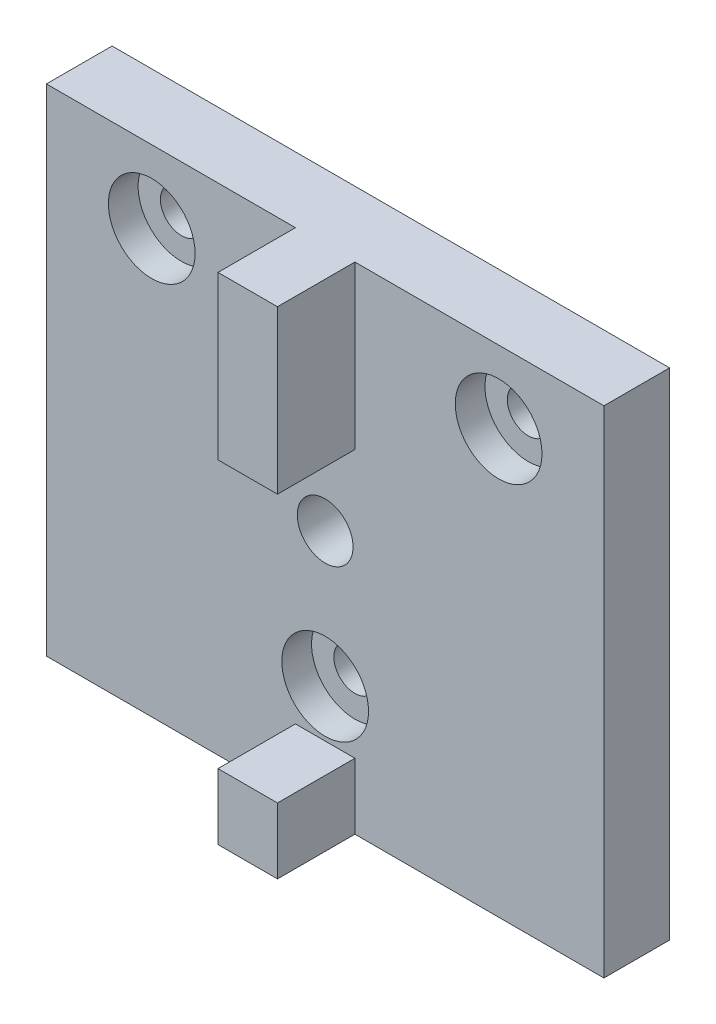
from build123d import *

# Parameters (mm, degrees)
BOSS_EXTRU_1_DEPTH                                 = 20
ESQUISSE19_W                                       = 4.8
ESQUISSE19_H                                       = 21.581272728
ENL_V_MAT_EXTRU_1_DEPTH                            = 6.25
CHAMBRAGE_POUR_VIS_T_TE_RONDE_BOMB_E_M_D           = 3.4
CHAMBRAGE_POUR_VIS_T_TE_RONDE_BOMB_E_M_CBORE_D     = 7
CHAMBRAGE_POUR_VIS_T_TE_RONDE_BOMB_E_M_CBORE_DEPTH = 2.4
D_GAGEMENT_M41_D                                   = 4.5


with BuildPart() as part:
    # Base → Boss.-Extru.1 (new, symmetric)
    with BuildSketch(Plane(origin=(0, 0, 0), x_dir=(1, 0, 0), z_dir=(0, 1, 0))):
        Polygon((-3, 10.061730862), (-2.4, 10.061730862), (-2.4, 3.811730862), (2.4, 3.811730862), (2.4, 10.061730862), (3, 10.061730862), (22.5, 10.061730862), (22.5, 15.361730862), (-22.5, 15.361730862), (-22.5, 10.061730862), align=None)
    extrude(amount=BOSS_EXTRU_1_DEPTH, both=True)

    # Esquisse19 → Enlèv. mat.-Extru.1 (cut)
    with BuildSketch(Plane.XY.offset(-3.811730862)):
        with Locations((0, -3.896618687)):
            Rectangle(ESQUISSE19_W, ESQUISSE19_H)
    extrude(amount=-ENL_V_MAT_EXTRU_1_DEPTH, mode=Mode.SUBTRACT)

    # Chambrage pour vis à tête ronde bombée M31 (through all)
    with Locations(Plane.XY.offset(-10.061730862)):
        with Locations((-14, 14.142273416), (14, 14.142273416), (0, -10.857726584)):
            CounterBoreHole(CHAMBRAGE_POUR_VIS_T_TE_RONDE_BOMB_E_M_D / 2, CHAMBRAGE_POUR_VIS_T_TE_RONDE_BOMB_E_M_CBORE_D / 2, CHAMBRAGE_POUR_VIS_T_TE_RONDE_BOMB_E_M_CBORE_DEPTH)

    # Dégagement M41 (through all)
    with Locations(Plane(origin=(0, 0, -15.361730862), x_dir=(-1, 0, 0), z_dir=(0, 0, -1))):
        with Locations((0, 0)):
            Hole(D_GAGEMENT_M41_D / 2)


solid = part.part
